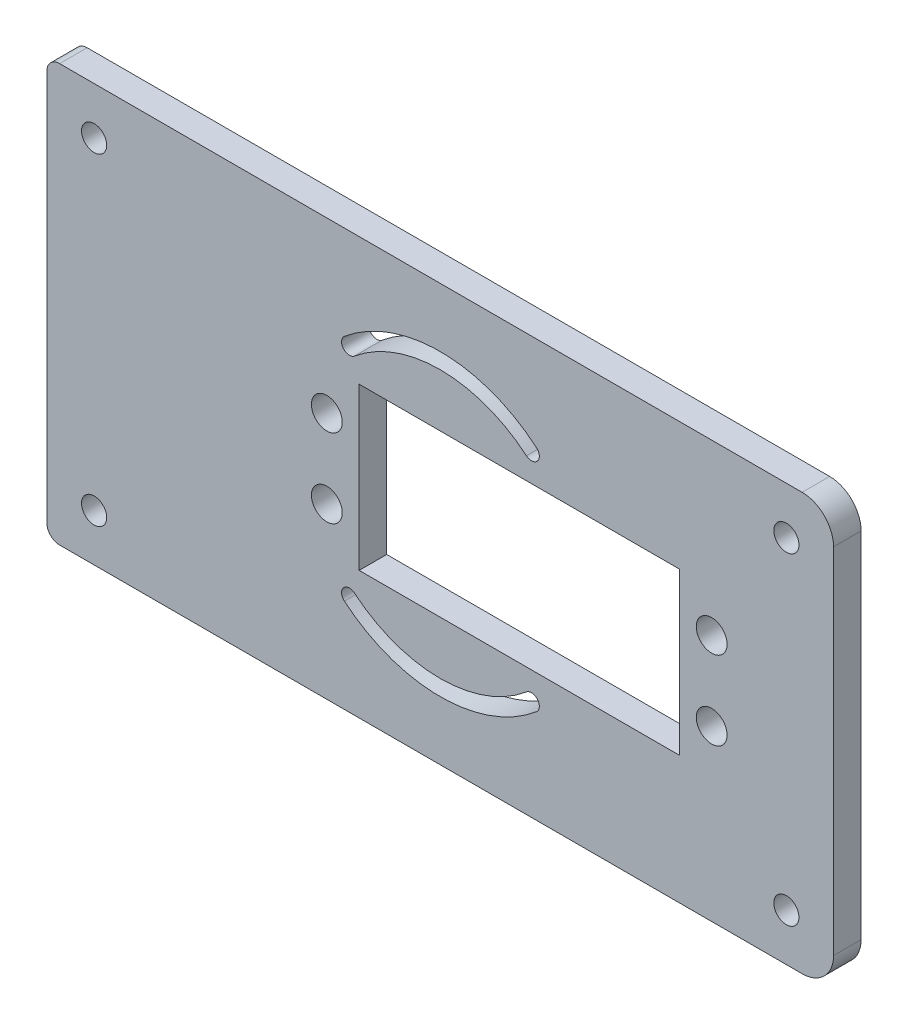
from build123d import *

# Parameters (mm, degrees)
SKETCH1_R           = 1.6
SKETCH1_R_2         = 1.961338098
SKETCH1_W           = 40.698202598
SKETCH1_H           = 20.498202598
BOSS_EXTRUDE1_DEPTH = 3.5


with BuildPart() as part:
    # Sketch1 → Boss-Extrude1 (new body)
    with BuildSketch(Plane.XY):
        with BuildLine():
            ThreePointArc((-50.044200549, -24.884800983), (-49.571119709, -26.026919161), (-48.429001531, -26.5))
            Line((-48.429001531, -26.5), (45.955799451, -26.5))
            ThreePointArc((45.955799451, -26.5), (48.784226576, -25.328427125), (49.955799451, -22.5))
            Line((49.955799451, -22.5), (49.955799451, 22.5))
            ThreePointArc((49.955799451, 22.5), (48.784226576, 25.328427125), (45.955799451, 26.5))
            Line((45.955799451, 26.5), (-48.429001531, 26.5))
            ThreePointArc((-48.429001531, 26.5), (-49.571119709, 26.026919161), (-50.044200549, 24.884800983))
            Line((-50.044200549, 24.884800983), (-50.044200549, -24.884800983))
        make_face()
        with Locations((-44.044200549, -20.5)):
            Circle(SKETCH1_R, mode=Mode.SUBTRACT)
        with Locations((-14.462088638, -5)):
            Circle(SKETCH1_R_2, mode=Mode.SUBTRACT)
        with BuildLine():
            ThreePointArc((12.196121371, -14.531845007), (-0.008459876, -18.999966384), (-12.229764581, -14.57779233))
            ThreePointArc((-12.229764581, -14.57779233), (-12.355671334, -13.169194626), (-10.94707363, -13.043287874))
            ThreePointArc((-10.94707363, -13.043287874), (-0.012222052, -16.999969923), (10.907666432, -13.002177111))
            ThreePointArc((10.907666432, -13.002177111), (12.31672785, -13.122783589), (12.196121371, -14.531845007))
        make_face(mode=Mode.SUBTRACT)
        with Locations((43.955799451, -20.5)):
            Circle(SKETCH1_R, mode=Mode.SUBTRACT)
        with Locations((10, 0)):
            Rectangle(SKETCH1_W, SKETCH1_H, mode=Mode.SUBTRACT)
        with Locations((34.462088638, -5)):
            Circle(SKETCH1_R_2, mode=Mode.SUBTRACT)
        with Locations((-14.462088638, 5)):
            Circle(SKETCH1_R_2, mode=Mode.SUBTRACT)
        with Locations((-44.044200549, 20.5)):
            Circle(SKETCH1_R, mode=Mode.SUBTRACT)
        with Locations((34.462088638, 5)):
            Circle(SKETCH1_R_2, mode=Mode.SUBTRACT)
        with BuildLine():
            ThreePointArc((-10.94707363, 13.043287874), (-12.355671334, 13.169194626), (-12.229764581, 14.57779233))
            ThreePointArc((-12.229764581, 14.57779233), (-0.008459876, 18.999966384), (12.196121371, 14.531845007))
            ThreePointArc((12.196121371, 14.531845007), (12.31672785, 13.122783589), (10.907666432, 13.002177111))
            ThreePointArc((10.907666432, 13.002177111), (-0.012222052, 16.999969923), (-10.94707363, 13.043287874))
        make_face(mode=Mode.SUBTRACT)
        with Locations((43.955799451, 20.5)):
            Circle(SKETCH1_R, mode=Mode.SUBTRACT)
    extrude(amount=BOSS_EXTRUDE1_DEPTH)


solid = part.part
